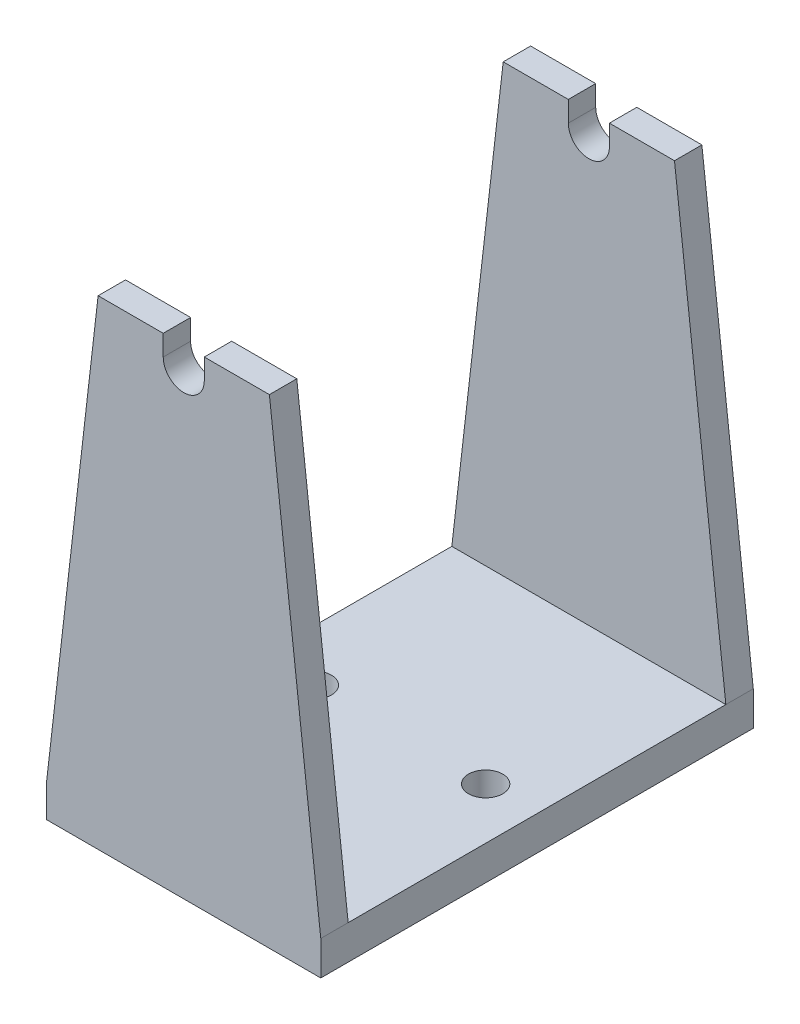
from build123d import *

# Parameters (mm, degrees)
ESTRUSIONE_ESTRUSIONE1_DEPTH = 4
SCHIZZO2_W                   = 40
SCHIZZO2_H                   = 5
ESTRUSIONE_ESTRUSIONE2_DEPTH = 55.13
ESTRUSIONE_ESTRUSIONE3_DEPTH = 4
SCHIZZO4_R                   = 2.5
TAGLIO_ESTRUSIONE1_DEPTH     = 93.792224351


with BuildPart() as part:
    # Schizzo1 → Estrusione-Estrusione1 (new body)
    with BuildSketch(Plane.XY):
        with BuildLine():
            Line((-20, 0), (20, 0))
            Line((20, 0), (20, 5))
            Line((20, 5), (12.5, 70))
            Line((12.5, 70), (2.997785692, 70))
            Line((2.997785692, 70), (2.997785692, 67))
            ThreePointArc((2.997785692, 67), (0, 64.002214308), (-2.997785692, 67))
            Line((-2.997785692, 67), (-2.997785692, 70))
            Line((-2.997785692, 70), (-12.5, 70))
            Line((-12.5, 70), (-20, 5))
            Line((-20, 5), (-20, 0))
        make_face()
    extrude(amount=ESTRUSIONE_ESTRUSIONE1_DEPTH)

    # Schizzo2 → Estrusione-Estrusione2 (add)
    with BuildSketch(Plane.XY.offset(4)):
        with Locations((0, 2.5)):
            Rectangle(SCHIZZO2_W, SCHIZZO2_H)
    extrude(amount=ESTRUSIONE_ESTRUSIONE2_DEPTH)

    # Schizzo3 → Estrusione-Estrusione3 (add)
    with BuildSketch(Plane.XY.offset(59.13)):
        with BuildLine():
            Line((20, 5), (12.5, 70))
            Line((12.5, 70), (2.997785692, 70))
            Line((2.997785692, 70), (2.997785692, 67))
            ThreePointArc((2.997785692, 67), (0, 64.002214308), (-2.997785692, 67))
            Line((-2.997785692, 67), (-2.997785692, 70))
            Line((-2.997785692, 70), (-12.5, 70))
            Line((-12.5, 70), (-20, 5))
            Line((-20, 5), (-20, 0))
            Line((-20, 0), (20, 0))
            Line((20, 0), (20, 5))
        make_face()
    extrude(amount=ESTRUSIONE_ESTRUSIONE3_DEPTH)

    # Schizzo4 → Taglio-Estrusione1 (cut, through all)
    with BuildSketch(Plane(origin=(0, 5, 0), x_dir=(1, 0, 0), z_dir=(0, 1, 0))):
        with Locations(Location((12.5, -31.565, 0), (0, 0, 270))):
            Circle(SCHIZZO4_R)
        with Locations(Location((-12.5, -31.565, 0), (0, 0, 270))):
            Circle(SCHIZZO4_R)
    extrude(amount=-TAGLIO_ESTRUSIONE1_DEPTH, mode=Mode.SUBTRACT)


solid = part.part
